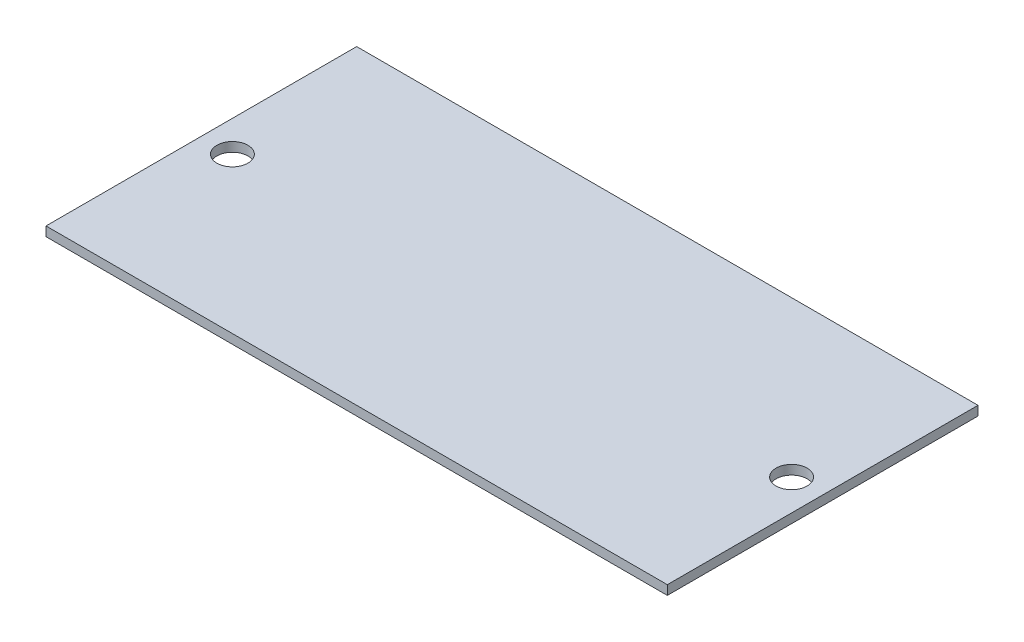
from build123d import *

# Parameters (mm, degrees)
ESBO_O5_W                = 100
ESBO_O5_H                = 50
RESSALTO_EXTRUS_O1_DEPTH = 1.5
ESBO_O6_R                = 2.5
CORTE_EXTRUS_O1_DEPTH    = 64.244340293


with BuildPart() as part:
    # Esboço5 → Ressalto-extrusão1 (new body)
    with BuildSketch(Plane(origin=(0, 0, 0), x_dir=(1, 0, 0), z_dir=(0, 1, 0))):
        with Locations((-2.03657542, 10.913665889)):
            Rectangle(ESBO_O5_W, ESBO_O5_H)
    extrude(amount=RESSALTO_EXTRUS_O1_DEPTH)

    # Esboço6 → Corte-extrusão1 (cut, through all)
    with BuildSketch(Plane(origin=(0, 0, 0), x_dir=(-1, 0, 0), z_dir=(0, -1, 0))):
        with Locations(Location((47.03657542, 10.913665889, 0), (0, 0, 90))):
            Circle(ESBO_O6_R)
        with Locations(Location((-42.96342458, 10.913665889, 0), (0, 0, 90))):
            Circle(ESBO_O6_R)
    extrude(amount=-CORTE_EXTRUS_O1_DEPTH, mode=Mode.SUBTRACT)


solid = part.part
